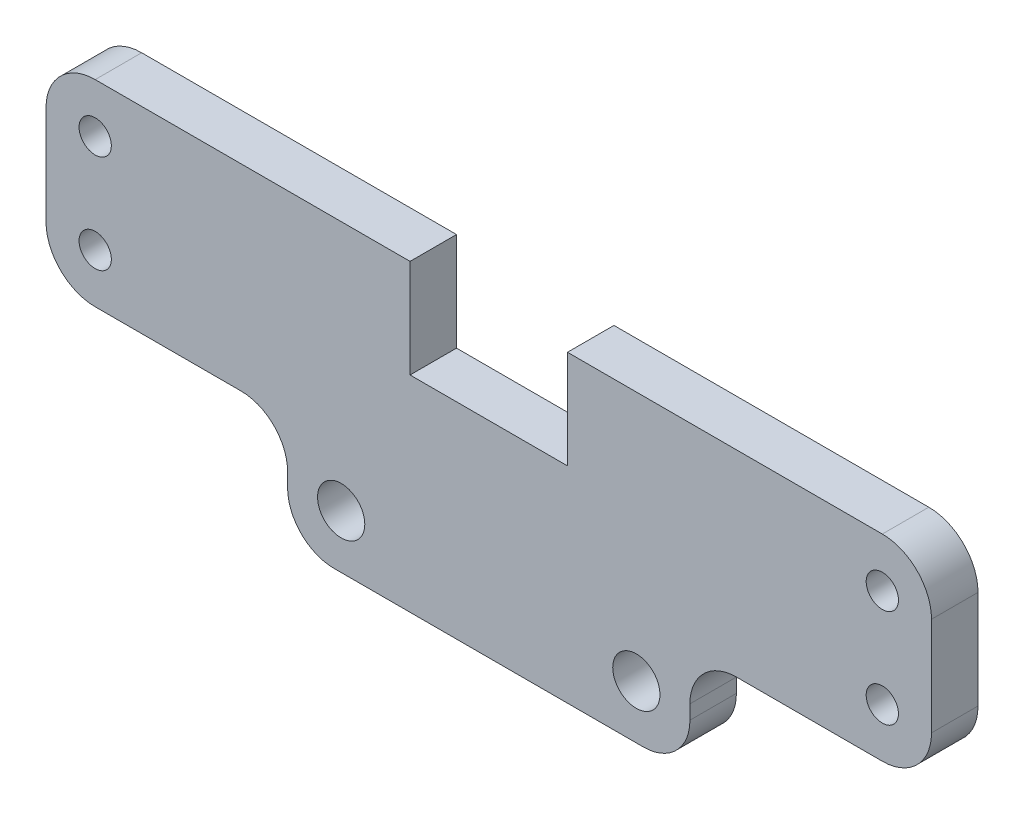
from build123d import *

# Parameters (mm, degrees)
SKETCH1_R            = 2.0828
BOSS_EXTRUDE1_DEPTH  = 3
SKETCH2_W            = 20.32
SKETCH2_H            = 12.7
CUT_EXTRUDE1_DEPTH   = 99.104736331
SKETCH3_W            = 25.964797213
SKETCH3_H            = 13.829594426
SKETCH3_R            = 3.048
BOSS_EXTRUDE2_DEPTH  = 6
FILLET1_R            = 6
FILLET1_OF_MIRROR1_R = 6


with BuildPart() as part:
    # Sketch1 → Boss-Extrude1 (new, symmetric)
    with BuildSketch(Plane.XY):
        with BuildLine():
            Line((-82.07375, -16.66875), (19.52625, -16.66875))
            ThreePointArc((19.52625, -16.66875), (24.016378061, -18.528621939), (25.87625, -23.01875))
            Line((25.87625, -23.01875), (25.87625, -35.71875))
            ThreePointArc((25.87625, -35.71875), (24.016378061, -40.208878061), (19.52625, -42.06875))
            Line((19.52625, -42.06875), (-82.07375, -42.06875))
            ThreePointArc((-82.07375, -42.06875), (-86.563878061, -40.208878061), (-88.42375, -35.71875))
            Line((-88.42375, -35.71875), (-88.42375, -23.01875))
            ThreePointArc((-88.42375, -23.01875), (-86.563878061, -18.528621939), (-82.07375, -16.66875))
        make_face()
        with Locations((-82.07375, -23.01875)):
            Circle(SKETCH1_R, mode=Mode.SUBTRACT)
        with Locations((19.52625, -23.01875)):
            Circle(SKETCH1_R, mode=Mode.SUBTRACT)
        with Locations((-82.07375, -35.71875)):
            Circle(SKETCH1_R, mode=Mode.SUBTRACT)
        with Locations((19.52625, -35.71875)):
            Circle(SKETCH1_R, mode=Mode.SUBTRACT)
    extrude(amount=BOSS_EXTRUDE1_DEPTH, both=True)

    # Sketch2 → Cut-Extrude1 (cut, through all)
    with BuildSketch(Plane.XY.offset(3)):
        with Locations((-31.27375, -23.01875)):
            Rectangle(SKETCH2_W, SKETCH2_H)
    extrude(amount=-CUT_EXTRUDE1_DEPTH, mode=Mode.SUBTRACT)

    # Sketch3 → Boss-Extrude2 (add)
    with BuildSketch(Plane.XY.offset(3)):
        with Locations((-44.256148607, -48.983547213)):
            Rectangle(SKETCH3_W, SKETCH3_H)
        with Locations((-50.32375, -48.983547213)):
            Circle(SKETCH3_R, mode=Mode.SUBTRACT)
    boss_extrude2 = extrude(amount=-BOSS_EXTRUDE2_DEPTH)

    # Fillet1
    fillet1_edges = [part.edges().sort_by_distance(p)[0] for p in [
        (-57.238547213, -42.06875, 0),
        (-57.238547213, -55.898344426, 0),
    ]]
    fillet(fillet1_edges, radius=FILLET1_R)

    # Mirror1: Boss-Extrude2 across plane
    add(boss_extrude2.mirror(Plane(origin=(-31.27375, -55.898344426, -3), x_dir=(0, 0, 1), z_dir=(1, 0, 0))))

    # Fillet1 of Mirror1
    fillet1_of_mirror1_edges = [part.edges().sort_by_distance(p)[0] for p in [
        (-5.308952787, -42.06875, 0),
        (-5.308952787, -55.898344426, 0),
    ]]
    fillet(fillet1_of_mirror1_edges, radius=FILLET1_OF_MIRROR1_R)


solid = part.part
